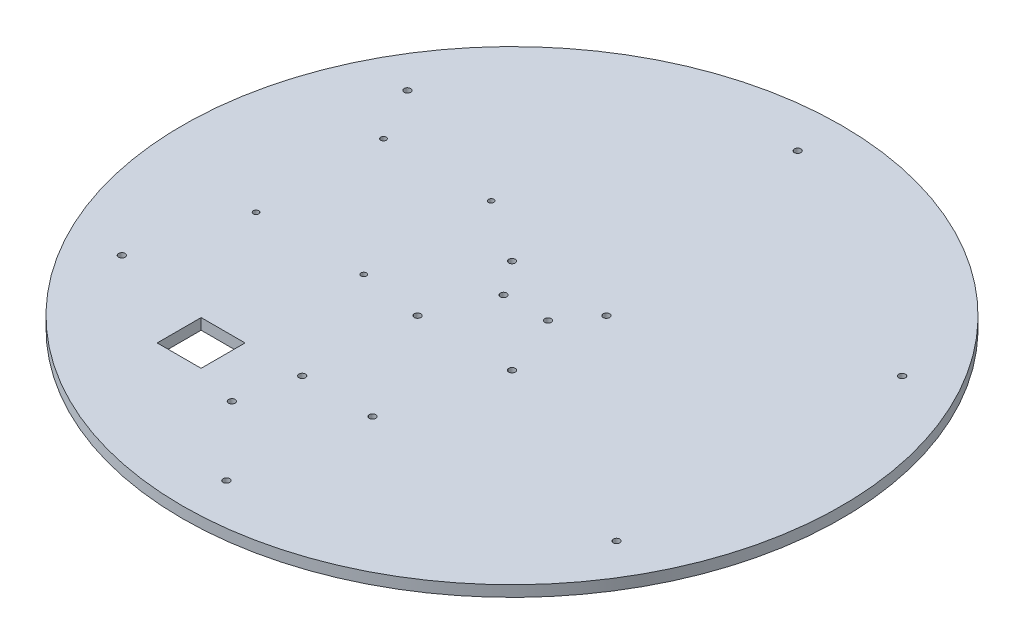
from build123d import *

# Parameters (mm, degrees)
SKETCH1_R           = 150
BOSS_EXTRUDE1_DEPTH = 5
SKETCH2_R           = 1.5
CUT_EXTRUDE1_DEPTH  = 5
SKETCH3_R           = 1.5
CUT_EXTRUDE2_DEPTH  = 5
SKETCH4_R           = 1.5
CUT_EXTRUDE3_DEPTH  = 5
SKETCH5_R           = 1.5
SKETCH5_W           = 20
SKETCH5_H           = 20
CUT_EXTRUDE4_DEPTH  = 5
SKETCH6_R           = 1.25
CUT_EXTRUDE5_DEPTH  = 5


with BuildPart() as part:
    # Sketch1 → Boss-Extrude1 (new body)
    with BuildSketch(Plane(origin=(0, 0, 0), x_dir=(1, 0, 0), z_dir=(0, 1, 0))):
        with Locations(Location((0, 0, 0), (0, 0, 270))):
            Circle(SKETCH1_R)
    extrude(amount=BOSS_EXTRUDE1_DEPTH)

    # Sketch2 → Cut-Extrude1 (cut)
    with BuildSketch(Plane(origin=(0, 5, 0), x_dir=(1, 0, 0), z_dir=(0, 1, 0))):
        with Locations(Location((0, 130, 0), (0, 0, 270))):
            Circle(SKETCH2_R)
        with Locations(Location((112.583302492, 65, 0), (0, 0, 270))):
            Circle(SKETCH2_R)
        with Locations(Location((112.583302492, -65, 0), (0, 0, 270))):
            Circle(SKETCH2_R)
        with Locations(Location((0, -130, 0), (0, 0, 270))):
            Circle(SKETCH2_R)
        with Locations(Location((-112.583302492, -65, 0), (0, 0, 270))):
            Circle(SKETCH2_R)
        with Locations(Location((-112.583302492, 65, 0), (0, 0, 270))):
            Circle(SKETCH2_R)
    extrude(amount=-CUT_EXTRUDE1_DEPTH, mode=Mode.SUBTRACT)

    # Sketch3 → Cut-Extrude2 (cut)
    with BuildSketch(Plane(origin=(0, 5, 0), x_dir=(1, 0, 0), z_dir=(0, 1, 0))):
        with Locations(Location((-10.1, 6.25, 0), (0, 0, 270))):
            Circle(SKETCH3_R)
        with Locations(Location((10.1, 6.25, 0), (0, 0, 270))):
            Circle(SKETCH3_R)
    extrude(amount=-CUT_EXTRUDE2_DEPTH, mode=Mode.SUBTRACT)

    # Sketch4 → Cut-Extrude3 (cut)
    with BuildSketch(Plane(origin=(0, 5, 0), x_dir=(1, 0, 0), z_dir=(0, 1, 0))):
        with Locations(Location((-21.5, 21.5, 0), (0, 0, 270))):
            Circle(SKETCH4_R)
        with Locations(Location((21.5, 21.5, 0), (0, 0, 270))):
            Circle(SKETCH4_R)
        with Locations(Location((-21.5, -21.5, 0), (0, 0, 270))):
            Circle(SKETCH4_R)
        with Locations(Location((21.5, -21.5, 0), (0, 0, 270))):
            Circle(SKETCH4_R)
    extrude(amount=-CUT_EXTRUDE3_DEPTH, mode=Mode.SUBTRACT)

    # Sketch5 → Cut-Extrude4 (cut)
    with BuildSketch(Plane(origin=(0, 5, 0), x_dir=(1, 0, 0), z_dir=(0, 1, 0))):
        with Locations(Location((-30, -97.5, 0), (0, 0, 270))):
            Circle(SKETCH5_R)
        with Locations(Location((-24, -71.5, 0), (0, 0, 270))):
            Circle(SKETCH5_R)
        with Locations(Location((8, -71.5, 0), (0, 0, 270))):
            Circle(SKETCH5_R)
        with Locations((-60, -81.5)):
            Rectangle(SKETCH5_W, SKETCH5_H)
    extrude(amount=-CUT_EXTRUDE4_DEPTH, mode=Mode.SUBTRACT)

    # Sketch6 → Cut-Extrude5 (cut)
    with BuildSketch(Plane(origin=(0, 5, 0), x_dir=(1, 0, 0), z_dir=(0, 1, 0))):
        with Locations(Location((-50, 40.5, 0), (0, 0, 270))):
            Circle(SKETCH6_R)
        with Locations(Location((-99, 40.5, 0), (0, 0, 270))):
            Circle(SKETCH6_R)
        with Locations(Location((-99, -17.5, 0), (0, 0, 270))):
            Circle(SKETCH6_R)
        with Locations(Location((-50, -17.5, 0), (0, 0, 270))):
            Circle(SKETCH6_R)
    extrude(amount=-CUT_EXTRUDE5_DEPTH, mode=Mode.SUBTRACT)


solid = part.part
